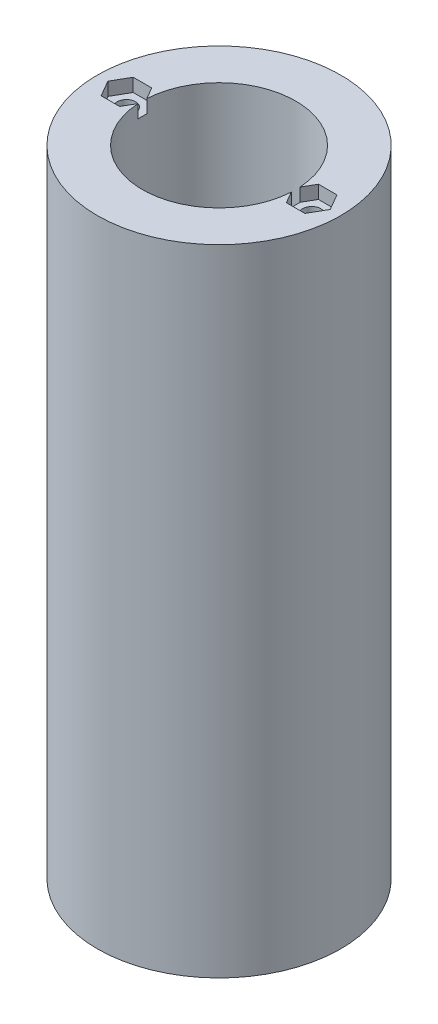
from build123d import *

# Parameters (mm, degrees)
SKETCH1_R           = 23
BOSS_EXTRUDE1_DEPTH = 120
SKETCH2_R           = 14.5
CUT_EXTRUDE1_DEPTH  = 120
CUT_EXTRUDE2_DEPTH  = 2.5
SKETCH5_R           = 1.75
CUT_EXTRUDE3_DEPTH  = 10
BOSS_EXTRUDE2_START = -5
SKETCH6_R           = 14.5
BOSS_EXTRUDE2_DEPTH = 5
SKETCH7_R           = 4
CUT_EXTRUDE4_DEPTH  = 5


with BuildPart() as part:
    # Sketch1 → Boss-Extrude1 (new body)
    with BuildSketch(Plane(origin=(0, 0, 0), x_dir=(1, 0, 0), z_dir=(0, 1, 0))):
        Circle(SKETCH1_R)
    extrude(amount=BOSS_EXTRUDE1_DEPTH)

    # Sketch2 → Cut-Extrude1 (cut)
    with BuildSketch(Plane(origin=(0, 120, 0), x_dir=(1, 0, 0), z_dir=(0, 1, 0))):
        Circle(SKETCH2_R)
    extrude(amount=-CUT_EXTRUDE1_DEPTH, mode=Mode.SUBTRACT)

    # Sketch4 → Cut-Extrude2 (cut)
    with BuildSketch(Plane(origin=(0, 120, 0), x_dir=(1, 0, 0), z_dir=(0, 1, 0))):
        Polygon((-14, 0), (-15.75, -3.031088913), (-19.25, -3.031088913), (-21, 0), (-19.25, 3.031088913), (-15.75, 3.031088913), align=None)
        Polygon((19.25, 3.031088913), (15.75, 3.031088913), (14, 0), (15.75, -3.031088913), (19.25, -3.031088913), (21, 0), align=None)
    extrude(amount=-CUT_EXTRUDE2_DEPTH, mode=Mode.SUBTRACT)

    # Sketch5 → Cut-Extrude3 (cut)
    with BuildSketch(Plane(origin=(0, 117.5, 0), x_dir=(1, 0, 0), z_dir=(0, 1, 0))):
        with Locations((-17.5, 0)):
            Circle(SKETCH5_R)
        with Locations((17.5, 0)):
            Circle(SKETCH5_R)
    extrude(amount=-CUT_EXTRUDE3_DEPTH, mode=Mode.SUBTRACT)

    # Sketch6 → Boss-Extrude2 (add)
    with BuildSketch(Plane(origin=(0, 0, 0), x_dir=(-1, 0, 0), z_dir=(0, -1, 0)).offset(BOSS_EXTRUDE2_START)):
        Circle(SKETCH6_R)
    extrude(amount=BOSS_EXTRUDE2_DEPTH)

    # Sketch7 → Cut-Extrude4 (cut)
    with BuildSketch(Plane.XZ):
        Circle(SKETCH7_R)
    extrude(amount=-CUT_EXTRUDE4_DEPTH, mode=Mode.SUBTRACT)


solid = part.part
